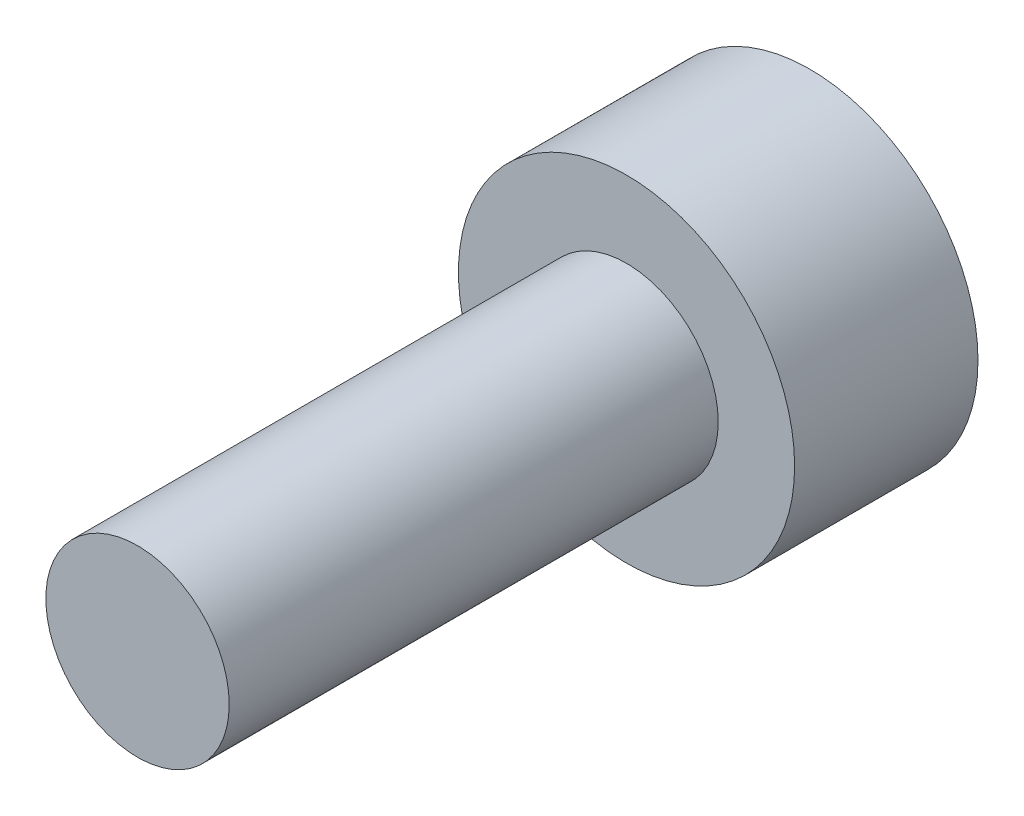
from build123d import *

# Parameters (mm, degrees)
ESBO_O1_R                = 2.75
RESSALTO_EXTRUS_O1_DEPTH = 3
ESBO_O2_R                = 1.5
RESSALTO_EXTRUS_O2_DEPTH = 8


with BuildPart() as part:
    # Esboço1 → Ressalto-extrusão1 (new body)
    with BuildSketch(Plane.XY):
        Circle(ESBO_O1_R)
    extrude(amount=RESSALTO_EXTRUS_O1_DEPTH)

    # Esboço2 → Ressalto-extrusão2 (add)
    with BuildSketch(Plane.XY.offset(3)):
        Circle(ESBO_O2_R)
    extrude(amount=RESSALTO_EXTRUS_O2_DEPTH)


solid = part.part
